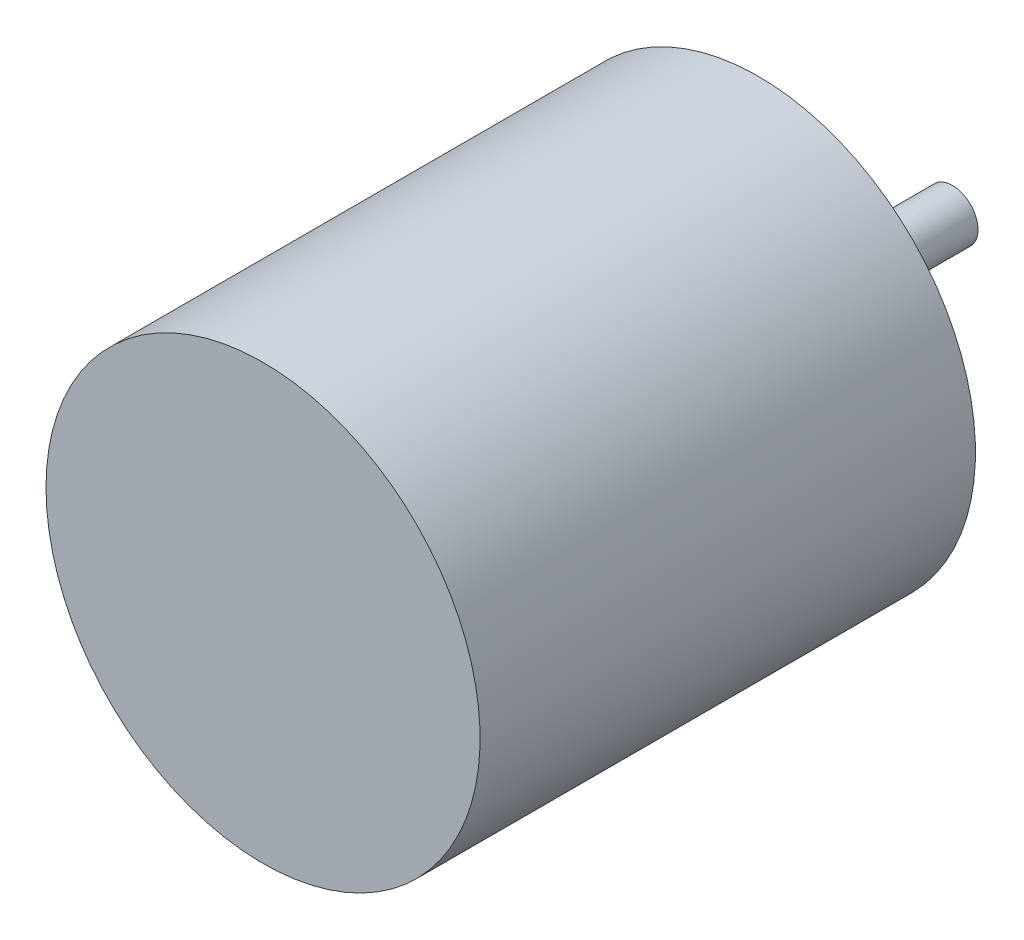
from build123d import *

# Parameters (mm, degrees)
ESBO_O1_R                = 21.25
RESSALTO_EXTRUS_O1_DEPTH = 24.25
ESBO_O2_R                = 2.5
RESSALTO_EXTRUS_O2_DEPTH = 19
ESBO_O3_R                = 1.5
CORTE_EXTRUS_O1_DEPTH    = 2


with BuildPart() as part:
    # Esboço1 → Ressalto-extrusão1 (new, symmetric)
    with BuildSketch(Plane.XY):
        with Locations(Location((0, 0, 0), (0, 0, 180))):
            Circle(ESBO_O1_R)
    extrude(amount=RESSALTO_EXTRUS_O1_DEPTH, both=True)

    # Esboço2 → Ressalto-extrusão2 (add)
    with BuildSketch(Plane(origin=(0, 0, -24.25), x_dir=(-1, 0, 0), z_dir=(0, 0, -1))):
        with Locations(Location((0, 0, 0), (0, 0, 180))):
            Circle(ESBO_O2_R)
    extrude(amount=RESSALTO_EXTRUS_O2_DEPTH)

    # Esboço3 → Corte-extrusão1 (cut)
    with BuildSketch(Plane(origin=(0, 0, -24.25), x_dir=(-1, 0, 0), z_dir=(0, 0, -1))):
        with Locations((-8.672819651, 9.001788672)):
            Circle(ESBO_O3_R)
        with Locations((9.001788672, 8.672819651)):
            Circle(ESBO_O3_R)
        with Locations((8.672819651, -9.001788672)):
            Circle(ESBO_O3_R)
        with Locations((-9.001788672, -8.672819651)):
            Circle(ESBO_O3_R)
    extrude(amount=-CORTE_EXTRUS_O1_DEPTH, mode=Mode.SUBTRACT)


solid = part.part
